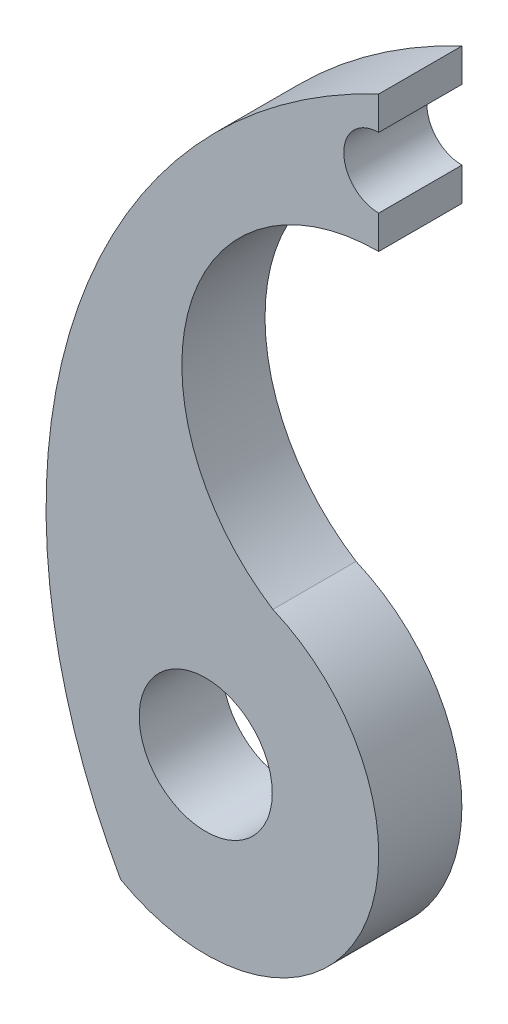
from build123d import *

# Parameters (mm, degrees)
SKETCH1_R           = 2.54
BOSS_EXTRUDE1_DEPTH = 3.175


with BuildPart() as part:
    # Sketch1 → Boss-Extrude1 (new body)
    with BuildSketch(Plane.XY):
        with BuildLine():
            Line((0, 27.813), (0, 26.543))
            ThreePointArc((0, 26.543), (-7.215038926, 21.131730585), (-4.040445833, 12.690132272))
            ThreePointArc((-4.040445833, 12.690132272), (-0.676998183, 3.691361084), (-9.855894217, 0.856130829))
            ThreePointArc((-9.855894217, 0.856130829), (-11.652031758, 18.448211646), (0, 31.75))
            Line((0, 31.75), (0, 30.48))
            ThreePointArc((0, 30.48), (-1.3335, 29.1465), (0, 27.813))
        make_face()
        with Locations((-6.604, 6.604)):
            Circle(SKETCH1_R, mode=Mode.SUBTRACT)
    extrude(amount=BOSS_EXTRUDE1_DEPTH)


solid = part.part
